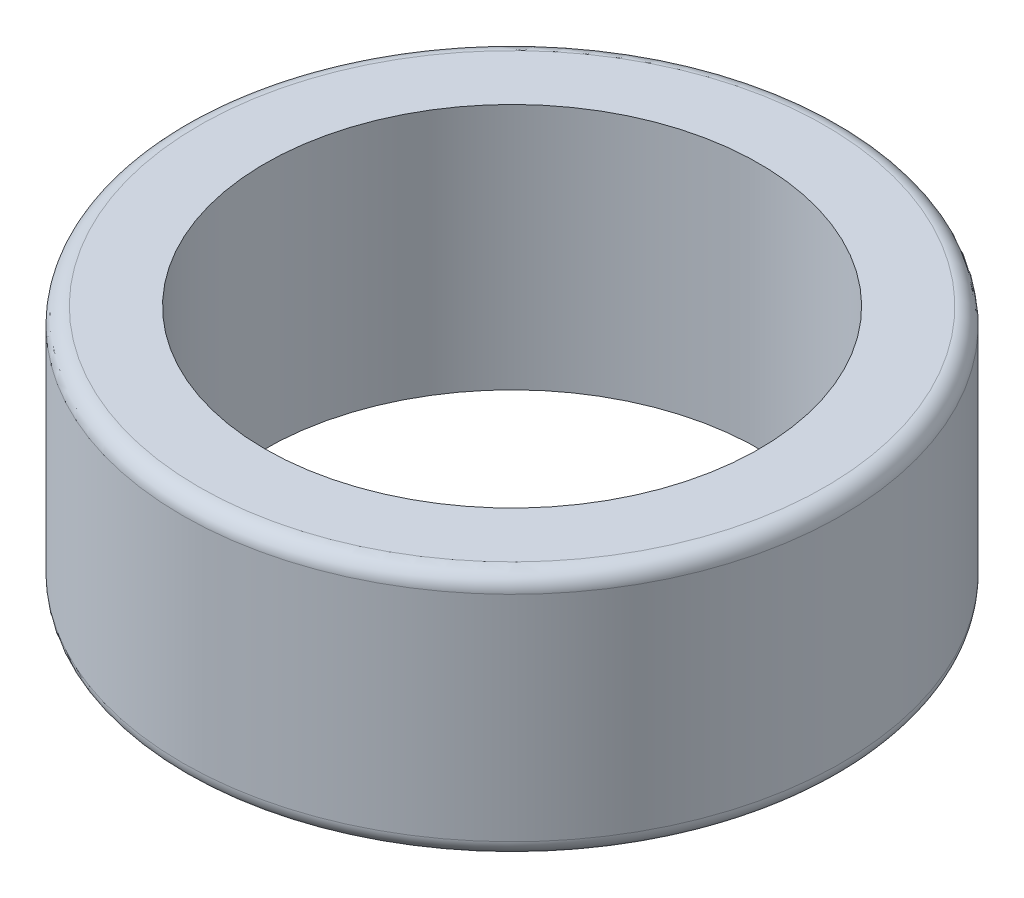
from build123d import *

# Parameters (mm, degrees)
SKIZZE1_R                       = 4
SKIZZE1_R_2                     = 3
AUFSATZ_LINEAR_AUSTRAGEN1_DEPTH = 3
VERRUNDUNG1_R                   = 0.2


with BuildPart() as part:
    # Skizze1 → Aufsatz-Linear austragen1 (new body)
    with BuildSketch(Plane(origin=(0, 0, 0), x_dir=(1, 0, 0), z_dir=(0, 1, 0))):
        with Locations(Location((0, 0, 0), (0, 0, 270))):
            Circle(SKIZZE1_R)
        with Locations(Location((0, 0, 0), (0, 0, 270))):
            Circle(SKIZZE1_R_2, mode=Mode.SUBTRACT)
    extrude(amount=AUFSATZ_LINEAR_AUSTRAGEN1_DEPTH)

    # Verrundung1
    verrundung1_edges = [part.edges().sort_by_distance(p)[0] for p in [
        (0, 0, -4),
        (0, 3, -4),
    ]]
    fillet(verrundung1_edges, radius=VERRUNDUNG1_R)


solid = part.part
